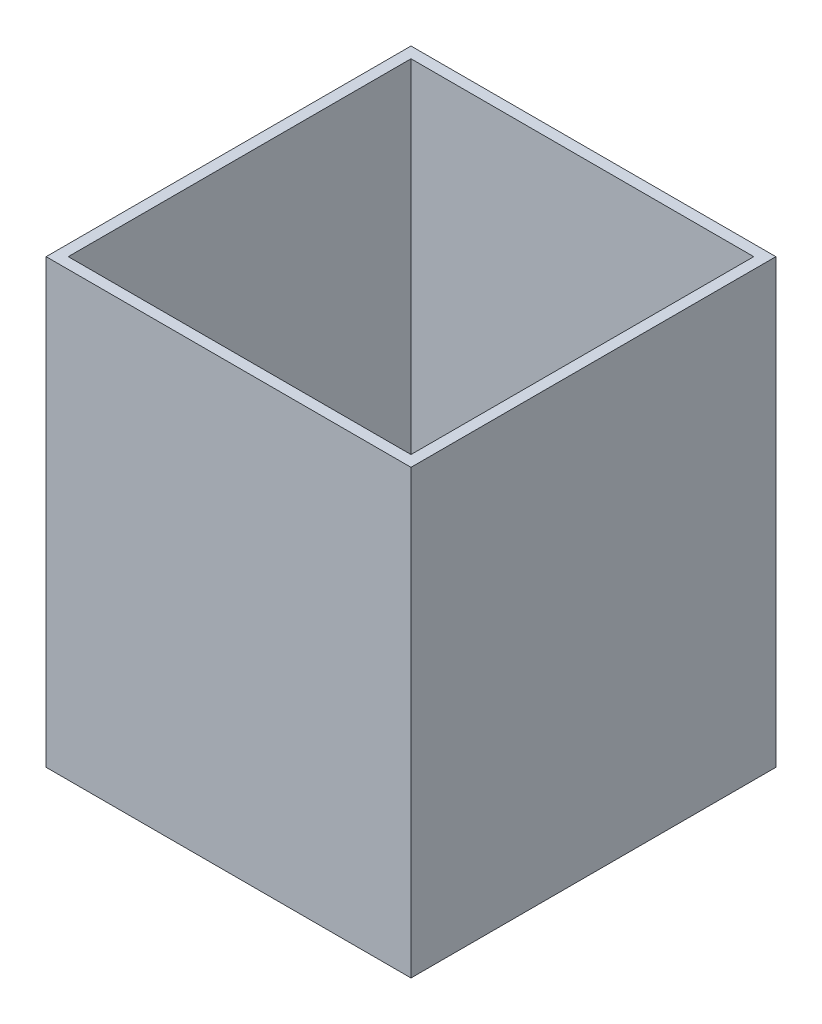
from build123d import *

# Parameters (mm, degrees)
SKETCH1_W           = 33
SKETCH1_H           = 33
SKETCH1_W_2         = 31
SKETCH1_H_2         = 31
BOSS_EXTRUDE2_DEPTH = 40
SKETCH2_W           = 31
SKETCH2_H           = 31
BOSS_EXTRUDE3_DEPTH = 1


with BuildPart() as part:
    # Sketch1 → Boss-Extrude2 (new body)
    with BuildSketch(Plane(origin=(0, 0, 0), x_dir=(1, 0, 0), z_dir=(0, 1, 0))):
        with Locations((16.5, 16.5)):
            Rectangle(SKETCH1_W, SKETCH1_H)
        with Locations((16.5, 16.5)):
            Rectangle(SKETCH1_W_2, SKETCH1_H_2, mode=Mode.SUBTRACT)
    extrude(amount=BOSS_EXTRUDE2_DEPTH)

    # Sketch2 → Boss-Extrude3 (add)
    with BuildSketch(Plane.XZ):
        with Locations((16.5, -16.5)):
            Rectangle(SKETCH2_W, SKETCH2_H)
    extrude(amount=-BOSS_EXTRUDE3_DEPTH)


solid = part.part
